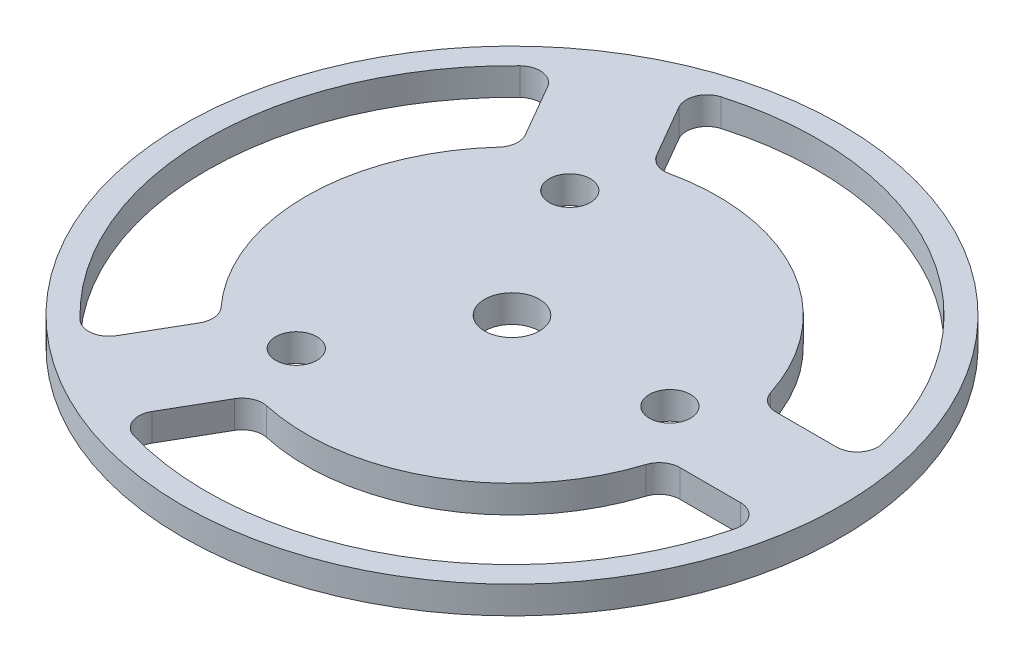
from build123d import *

# Parameters (mm, degrees)
SKETCH1_R           = 24
SKETCH1_R_2         = 2
SKETCH1_R_3         = 1.5
BOSS_EXTRUDE1_DEPTH = 2
CUT_EXTRUDE1_DEPTH  = 2
FILLET1_R           = 1.5


with BuildPart() as part:
    # Sketch1 → Boss-Extrude1 (new body)
    with BuildSketch(Plane(origin=(0, 0, 0), x_dir=(1, 0, 0), z_dir=(0, 1, 0))):
        with Locations(Location((0, 0, 0), (0, 0, 270))):
            Circle(SKETCH1_R)
        with Locations(Location((0, 0, 0), (0, 0, 270))):
            Circle(SKETCH1_R_2, mode=Mode.SUBTRACT)
        with Locations(Location((11.5, 0, 0), (0, 0, 270))):
            Circle(SKETCH1_R_3, mode=Mode.SUBTRACT)
        with Locations(Location((-5.75, -9.959292144, 0), (0, 0, 270))):
            Circle(SKETCH1_R_3, mode=Mode.SUBTRACT)
        with Locations(Location((-5.75, 9.959292144, 0), (0, 0, 270))):
            Circle(SKETCH1_R_3, mode=Mode.SUBTRACT)
    extrude(amount=BOSS_EXTRUDE1_DEPTH)

    # Sketch2 → Cut-Extrude1 (cut)
    with BuildSketch(Plane(origin=(0, 2, 0), x_dir=(1, 0, 0), z_dir=(0, 1, 0))):
        with BuildLine():
            Line((21.972994789, 3.5), (14.585952146, 3.5))
            ThreePointArc((14.585952146, 3.5), (7.5, 12.990381057), (-4.26188716, 14.381805097))
            Line((-4.26188716, 14.381805097), (-7.955408481, 20.779171685))
            ThreePointArc((-7.955408481, 20.779171685), (11.125, 19.269065234), (21.972994789, 3.5))
        make_face()
        with BuildLine():
            Line((21.972994789, -3.5), (14.585952146, -3.5))
            ThreePointArc((14.585952146, -3.5), (7.5, -12.990381057), (-4.26188716, -14.381805097))
            Line((-4.26188716, -14.381805097), (-7.955408481, -20.779171685))
            ThreePointArc((-7.955408481, -20.779171685), (11.125, -19.269065234), (21.972994789, -3.5))
        make_face()
        with BuildLine():
            Line((-14.017586308, -17.279171685), (-10.324064986, -10.881805097))
            ThreePointArc((-10.324064986, -10.881805097), (-15, 0), (-10.324064986, 10.881805097))
            Line((-10.324064986, 10.881805097), (-14.017586308, 17.279171685))
            ThreePointArc((-14.017586308, 17.279171685), (-22.25, 0), (-14.017586308, -17.279171685))
        make_face()
    extrude(amount=-CUT_EXTRUDE1_DEPTH, mode=Mode.SUBTRACT)

    # Fillet1
    fillet1_edges = [part.edges().sort_by_distance(p)[0] for p in [
        (-7.955408481, 1, -20.779171685),
        (21.972994789, 1, -3.5),
        (14.585952146, 1, -3.5),
        (-4.26188716, 1, -14.381805097),
        (-14.017586308, 1, 17.279171685),
        (-14.017586308, 1, -17.279171685),
        (-10.324064986, 1, -10.881805097),
        (-10.324064986, 1, 10.881805097),
        (21.972994789, 1, 3.5),
        (-7.955408481, 1, 20.779171685),
        (-4.26188716, 1, 14.381805097),
        (14.585952146, 1, 3.5),
    ]]
    fillet(fillet1_edges, radius=FILLET1_R)


solid = part.part
